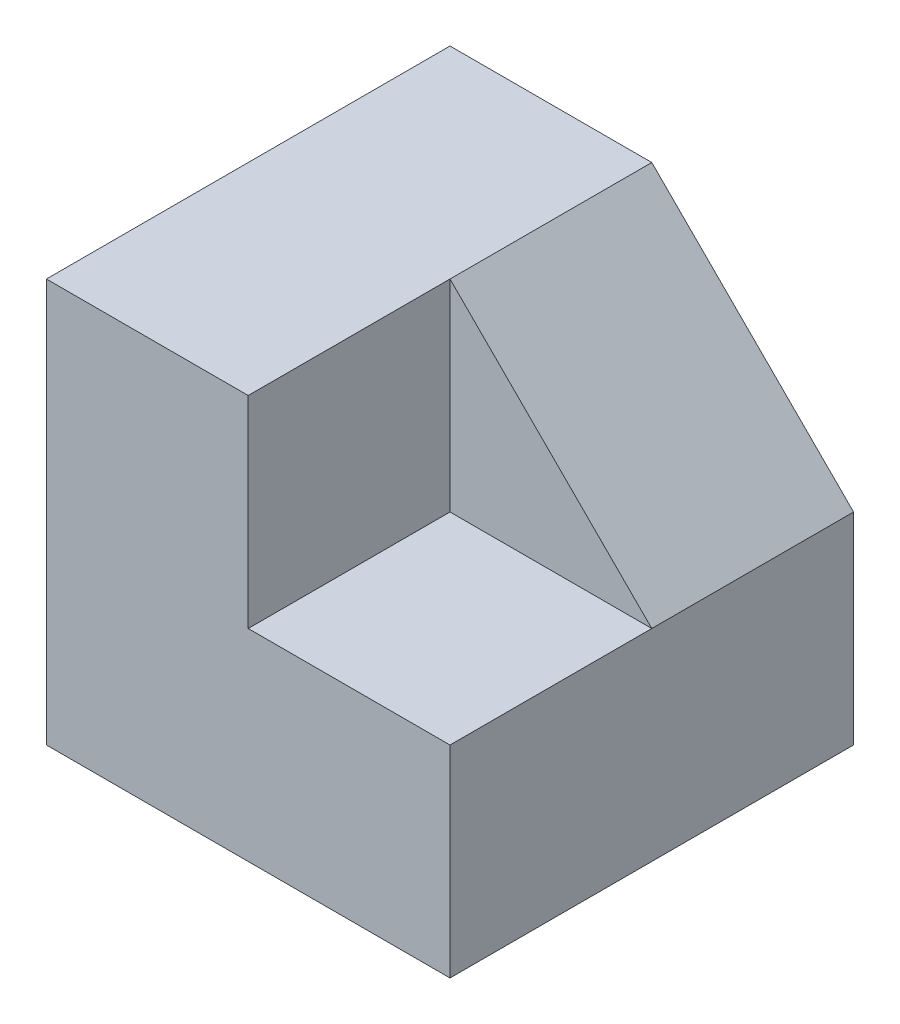
from build123d import *

# Parameters (mm, degrees)
CROQUIS1_W              = 60
CROQUIS1_H              = 60
SALIENTE_EXTRUIR1_DEPTH = 30
SALIENTE_EXTRUIR2_DEPTH = 30
CHAFL_N1_SIZE           = 30


with BuildPart() as part:
    # Croquis1 → Saliente-Extruir1 (new body)
    with BuildSketch(Plane(origin=(0, 0, 0), x_dir=(1, 0, 0), z_dir=(0, 1, 0))):
        Rectangle(CROQUIS1_W, CROQUIS1_H)
    extrude(amount=SALIENTE_EXTRUIR1_DEPTH)

    # Croquis2 → Saliente-Extruir2 (add)
    with BuildSketch(Plane(origin=(0, 30, 0), x_dir=(1, 0, 0), z_dir=(0, 1, 0))):
        Polygon((0, -30), (0, 0), (30, 0), (30, 30), (-30, 30), (-30, -30), align=None)
    extrude(amount=SALIENTE_EXTRUIR2_DEPTH)

    # Chaflán1
    chafl_n1_edges = [part.edges().sort_by_distance(p)[0] for p in [
        (30, 60, -15),
    ]]
    chamfer(chafl_n1_edges, length=CHAFL_N1_SIZE)


solid = part.part
